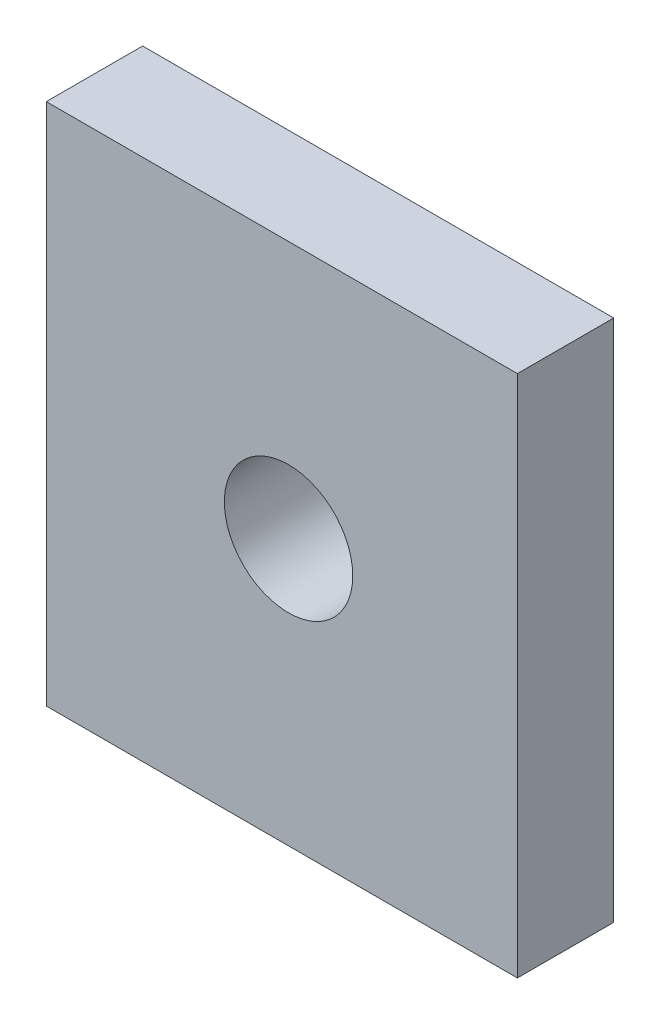
from build123d import *

# Parameters (mm, degrees)
SKETCH1_W           = 73.368528588
SKETCH1_H           = 81.52058732
SKETCH1_R           = 10
BOSS_EXTRUDE1_DEPTH = 15


with BuildPart() as part:
    # Sketch1 → Boss-Extrude1 (new body)
    with BuildSketch(Plane.XY):
        with Locations((-1.042705187, -0.663539664)):
            Rectangle(SKETCH1_W, SKETCH1_H)
        Circle(SKETCH1_R, mode=Mode.SUBTRACT)
    extrude(amount=BOSS_EXTRUDE1_DEPTH)


solid = part.part
